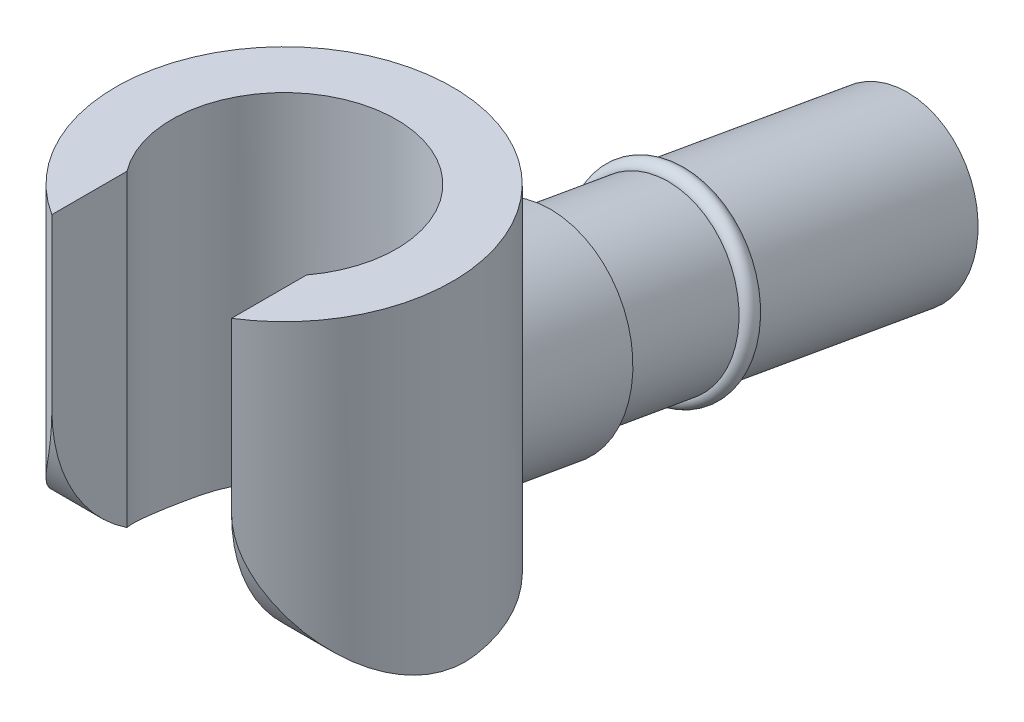
from build123d import *

# Parameters (mm, degrees)
SKETCH2_R                = 2.38125
SKETCH2_R_2              = 1.5875000000000001
BOSS_EXTRUDE1_DEPTH      = 4.7625
SKETCH3_W                = 2.54
SKETCH3_H                = 2.54
CUT_EXTRUDE1_DEPTH       = 6.832847450002443
CUT_EXTRUDE2_DEPTH       = 7.456267061932925
CUT_EXTRUDE2_DEPTH_BACK  = 7.456267061932925
BOSS_EXTRUDE2_REACH      = 13.721
BOSS_EXTRUDE2_END_RADIUS = 2.38125
SKETCH6_R                = 1.1906250000000003
BOSS_EXTRUDE3_REACH      = 19.432
BOSS_EXTRUDE3_END_RADIUS = 2.38125
BOSS_EXTRUDE3_START      = -5.159375
SKETCH7_R                = 1.3881469237206399
SKETCH8_R                = 0.1270000000001564


with BuildPart() as part:
    # Sketch2 → Boss-Extrude1 (new body)
    with BuildSketch(Plane(origin=(0, 0, 0), x_dir=(1, 0, 0), z_dir=(0, 1, 0))):
        with Locations(Location((0, 0, 0), (0, 0, 90))):
            Circle(SKETCH2_R)
        with Locations(Location((0, 0, 0), (0, 0, 90))):
            Circle(SKETCH2_R_2, mode=Mode.SUBTRACT)
    extrude(amount=BOSS_EXTRUDE1_DEPTH)

    # Sketch3 → Cut-Extrude1 (cut, through all)
    with BuildSketch(Plane(origin=(0, 4.7625, 0), x_dir=(1, 0, 0), z_dir=(0, 1, 0))):
        with Locations((0, -2.2225)):
            Rectangle(SKETCH3_W, SKETCH3_H)
    extrude(amount=-CUT_EXTRUDE1_DEPTH, mode=Mode.SUBTRACT)

    # Sketch4 → Cut-Extrude2 (cut, two sides: drawn at the far end of the back side and taken through both)
    with BuildSketch(Plane(origin=(-1.27, 0, 0), x_dir=(0, 0, -1), z_dir=(1, 0, 0)).offset(-CUT_EXTRUDE2_DEPTH_BACK)):
        with BuildLine():
            Line((0.3669383154536387, 0), (-2.014311684546361, 0))
            Line((-2.014311684546361, 0), (-2.0143116845463607, 2.38125))
            ThreePointArc((-2.0143116845463607, 2.38125), (-1.3168597072468262, 0.6974519772995338), (0.3669383154536387, 0))
        make_face()
    extrude(amount=CUT_EXTRUDE2_DEPTH + CUT_EXTRUDE2_DEPTH_BACK, mode=Mode.SUBTRACT)

    # Boss-Extrude2: up to this cylinder (the profile starts outside it)
    boss_extrude2_end = Plane(origin=(0, 0.31226100000000034, 0), z_dir=(0, -1, 0)) * Cylinder(BOSS_EXTRUDE2_END_RADIUS, 33.2045, mode=Mode.PRIVATE)
    # Sketch6 → Boss-Extrude2 (add, up to the surface)
    with BuildSketch(Plane(origin=(0, 0.48483407181496907, -8.634779231627519), x_dir=(-1, 0, 0), z_dir=(0, -0.17364817766693408, -0.9848077530122075)), mode=Mode.PRIVATE) as boss_extrude2_sk1:
        with Locations(Location((4.3e-16, -0.17523538418624157, 0), (0, 0, 90))):
            Circle(SKETCH6_R)
    boss_extrude2_tool1 = extrude(boss_extrude2_sk1.sketch, amount=-BOSS_EXTRUDE2_REACH, mode=Mode.PRIVATE) - boss_extrude2_end
    add(boss_extrude2_tool1.solids().sort_by_distance((0, 0.312261, -8.60435))[0])

    # Boss-Extrude3: up to this cylinder (the profile starts outside it)
    boss_extrude3_end = Plane(origin=(0, 1.208177, 0), z_dir=(0, -1, 0)) * Cylinder(BOSS_EXTRUDE3_END_RADIUS, 44.6265, mode=Mode.PRIVATE)
    # Sketch7 → Boss-Extrude3 (add, up to the surface)
    with BuildSketch(Plane(origin=(0, -1.4620146790809783, -8.291497269485987), x_dir=(-1, 0, 0), z_dir=(0, -0.1736481776669341, -0.9848077530122075)).offset(BOSS_EXTRUDE3_START), mode=Mode.PRIVATE) as boss_extrude3_sk1:
        with Locations(Location((4.3e-16, 1.8016466467900256, 0), (0, 0, 90))):
            Circle(SKETCH7_R)
    boss_extrude3_tool1 = extrude(boss_extrude3_sk1.sketch, amount=-BOSS_EXTRUDE3_REACH, mode=Mode.PRIVATE) - boss_extrude3_end
    add(boss_extrude3_tool1.solids().sort_by_distance((0, 1.208177, -3.523357))[0])

    # Sketch8 → Revolve1 (revolve)
    with BuildSketch(Plane(origin=(0, 0, 0), x_dir=(0, 0, -1), z_dir=(1, 0, 0))):
        with Locations((5.55625, 2.0587154735803463)):
            Circle(SKETCH8_R)
    revolve(axis=Axis((-4.3e-16, 2.2625512819876596, 2.4562964209001934), (0, -0.17364817766693408, -0.9848077530122075)))


solid = part.part
